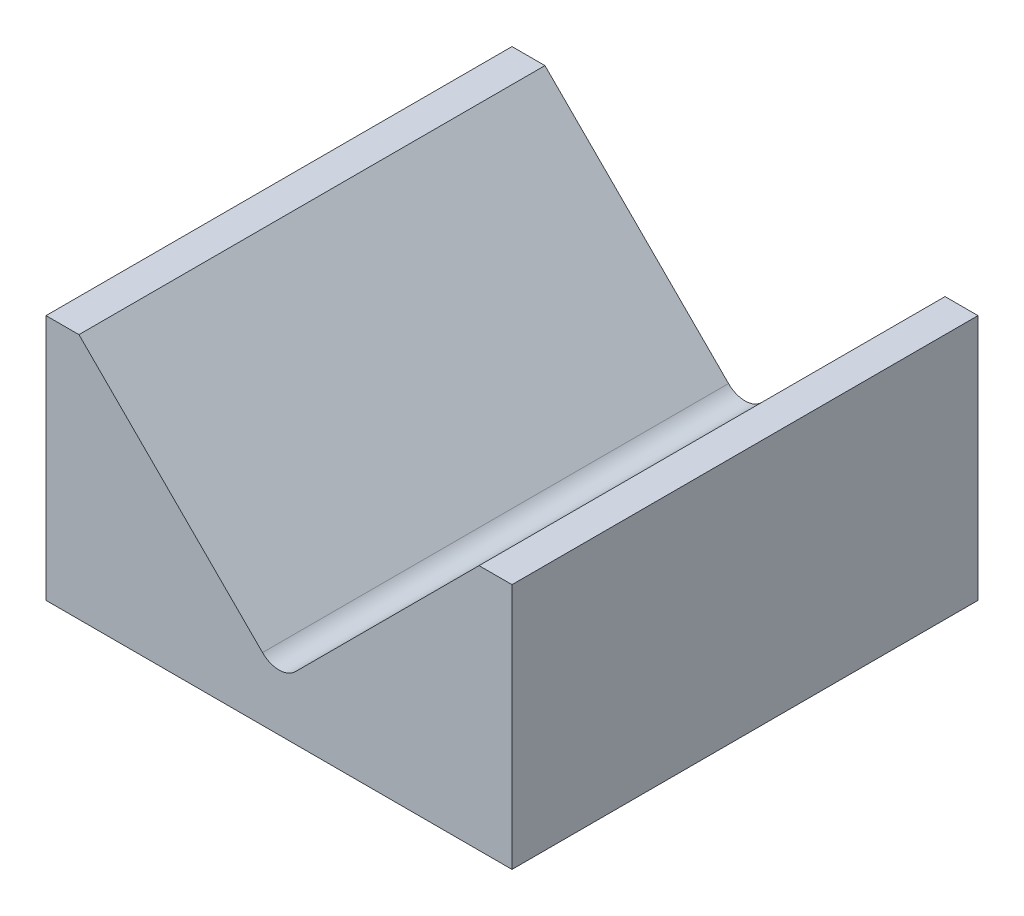
from build123d import *
from OCP.BRepFilletAPI import BRepFilletAPI_MakeChamfer

# Parameters (mm, degrees)
EXTRUDE_1_DEPTH = 10
FILLET_1_R      = 0.5
CHAMFER_1_SIZE  = 1
CHAMFER_1_SIZE2 = 0.707106781


with BuildPart() as part:
    # 草图2 → 凸台-拉伸1 (new body)
    with BuildSketch(Plane.XY):
        Polygon((0, 0), (0, 6), (5, 1), (10, 6), (10, 0), align=None)
    extrude(amount=EXTRUDE_1_DEPTH)

    # 圆角1
    fillet_1_edges = [part.edges().sort_by_distance(p)[0] for p in [
        (5, 1, 5),
    ]]
    fillet(fillet_1_edges, radius=FILLET_1_R)

    # 倒角1: one chamfer whose edges measure the first distance from different faces: ONE call of the kernel's chamfer builder (chamfer() names one face for all edges)
    chamfer_1_edges_1 = [part.edges().sort_by_distance(p)[0] for p in [
        (0, 6, 5),
    ]]
    chamfer_1_side_1 = [part.faces().sort_by_distance(p)[0] for p in [
        (2.323223305, 3.676776695, 5),
    ]]
    chamfer_1_edges_2 = [part.edges().sort_by_distance(p)[0] for p in [
        (10, 6, 5),
    ]]
    chamfer_1_side_2 = [part.faces().sort_by_distance(p)[0] for p in [
        (7.676776695, 3.676776695, 5),
    ]]
    chamfer_1 = BRepFilletAPI_MakeChamfer(part.part.solid().wrapped)
    for e in chamfer_1_edges_1:
        chamfer_1.Add(CHAMFER_1_SIZE, CHAMFER_1_SIZE2, e.wrapped, chamfer_1_side_1[0].wrapped)  # the first distance lies on this face
    for e in chamfer_1_edges_2:
        chamfer_1.Add(CHAMFER_1_SIZE, CHAMFER_1_SIZE2, e.wrapped, chamfer_1_side_2[0].wrapped)  # the first distance lies on this face
    add(Compound.cast(chamfer_1.Shape()), mode=Mode.REPLACE)


solid = part.part
